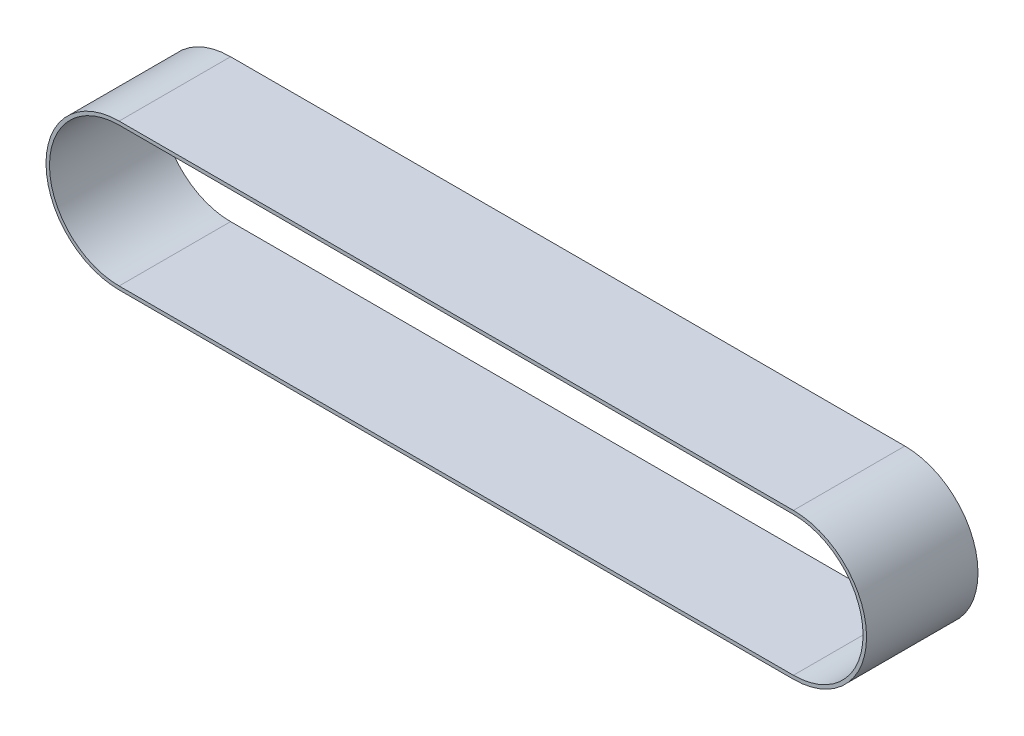
from build123d import *

# Parameters (mm, degrees)
BOSS_EXTRUDE1_DEPTH = 50.8


with BuildPart() as part:
    # Sketch1 → Boss-Extrude1 (new body)
    with BuildSketch(Plane.XY):
        with BuildLine():
            Line((0, 33.3375), (307.34, 33.3375))
            ThreePointArc((307.34, 33.3375), (340.6775, 0), (307.34, -33.3375))
            Line((307.34, -33.3375), (0, -33.3375))
            ThreePointArc((0, -33.3375), (-33.3375, 0), (0, 33.3375))
        make_face()
        with BuildLine():
            Line((0, 31.75), (307.34, 31.75))
            ThreePointArc((307.34, 31.75), (339.09, 0), (307.34, -31.75))
            Line((307.34, -31.75), (0, -31.75))
            ThreePointArc((0, -31.75), (-31.75, 0), (0, 31.75))
        make_face(mode=Mode.SUBTRACT)
    extrude(amount=BOSS_EXTRUDE1_DEPTH)


solid = part.part
